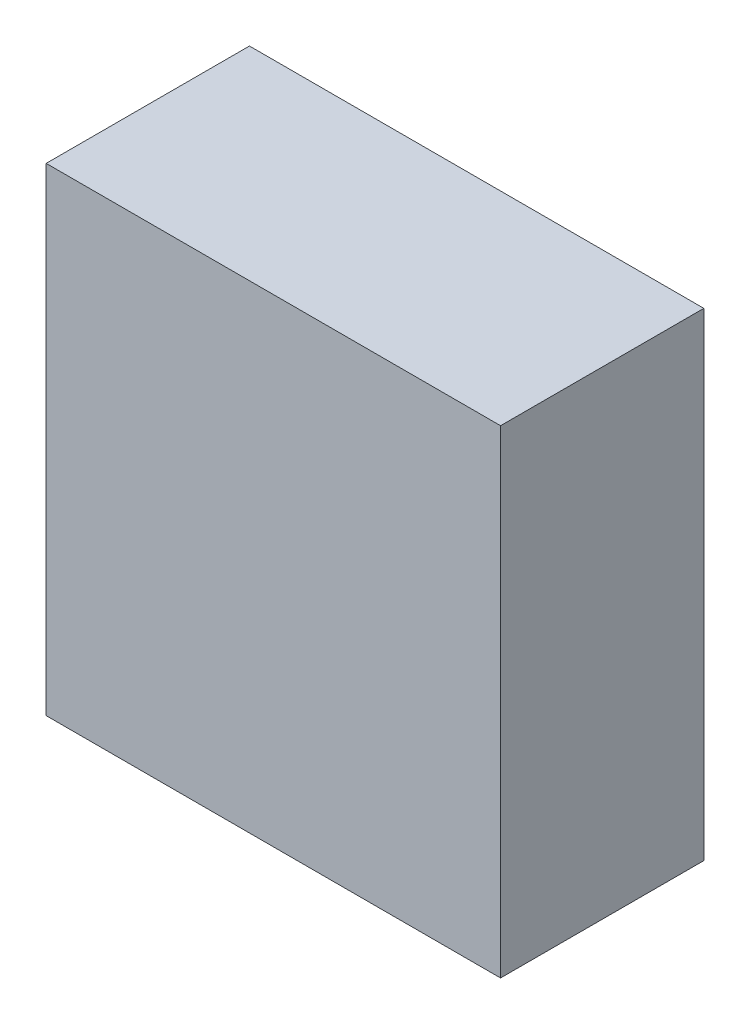
from build123d import *

# Parameters (mm, degrees)
SKETCH1_W           = 28.956
SKETCH1_H           = 12.954
BOSS_EXTRUDE1_DEPTH = 30.48


with BuildPart() as part:
    # Sketch1 → Boss-Extrude1 (new body)
    with BuildSketch(Plane(origin=(0, 0, 0), x_dir=(1, 0, 0), z_dir=(0, 1, 0))):
        Rectangle(SKETCH1_W, SKETCH1_H)
    extrude(amount=BOSS_EXTRUDE1_DEPTH)


solid = part.part
